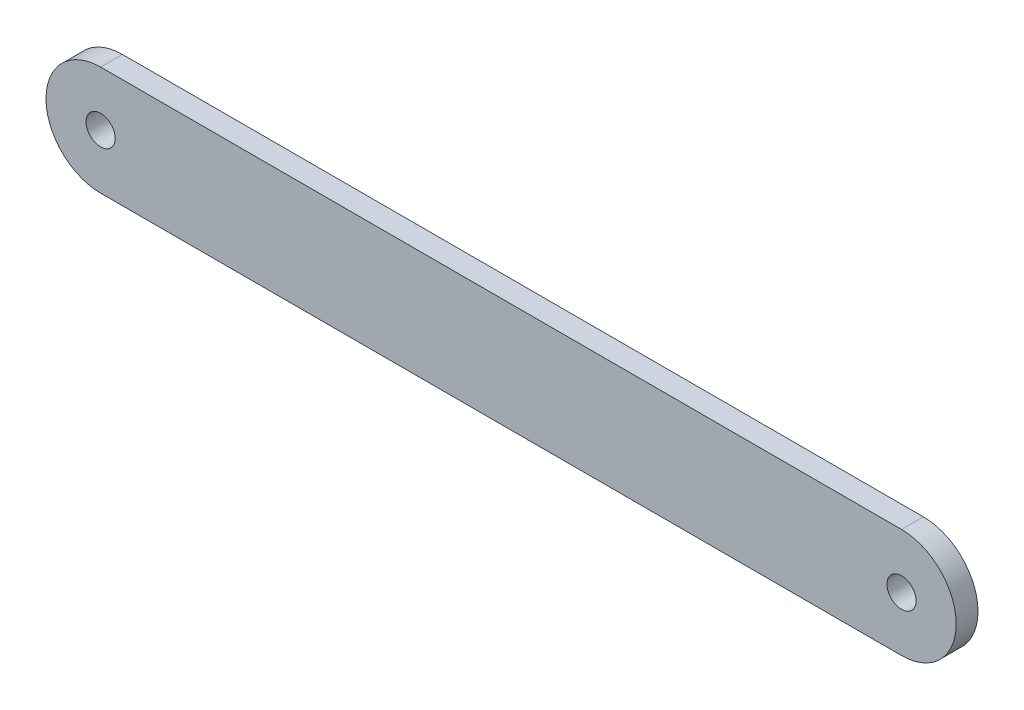
from build123d import *

# Parameters (mm, degrees)
SKETCH1_R           = 2
BOSS_EXTRUDE1_DEPTH = 3


with BuildPart() as part:
    # Sketch1 → Boss-Extrude1 (new body)
    with BuildSketch(Plane.XY):
        with BuildLine():
            Line((0, 7.5), (110, 7.5))
            ThreePointArc((110, 7.5), (117.5, 0), (110, -7.5))
            Line((110, -7.5), (0, -7.5))
            ThreePointArc((0, -7.5), (-7.5, 0), (0, 7.5))
        make_face()
        Circle(SKETCH1_R, mode=Mode.SUBTRACT)
        with Locations((110, 0)):
            Circle(SKETCH1_R, mode=Mode.SUBTRACT)
    extrude(amount=BOSS_EXTRUDE1_DEPTH)


solid = part.part
